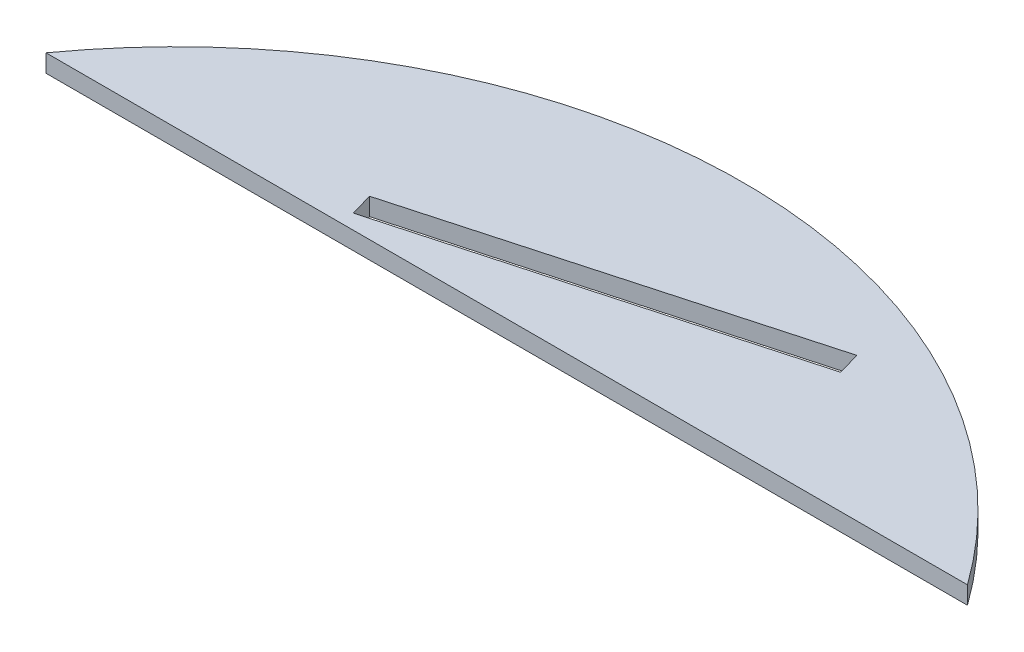
from build123d import *

# Parameters (mm, degrees)
SKETCH1_R           = 48
BOSS_EXTRUDE1_DEPTH = 1.5
CUT_EXTRUDE1_START  = -1.5
CUT_EXTRUDE1_DEPTH  = 1.5
CUT_EXTRUDE2_DEPTH  = 1.5


with BuildPart() as part:
    # Sketch1 → Boss-Extrude1 (new body)
    with BuildSketch(Plane(origin=(0, 0, 0), x_dir=(1, 0, 0), z_dir=(0, 1, 0))):
        with Locations(Location((0, 0, 0), (0, 0, 270))):
            Circle(SKETCH1_R)
    extrude(amount=BOSS_EXTRUDE1_DEPTH)

    # Sketch2 → Cut-Extrude1 (cut)
    with BuildSketch(Plane(origin=(0, 1.5, 0), x_dir=(1, 0, 0), z_dir=(0, 1, 0)).offset(CUT_EXTRUDE1_START)):
        with BuildLine():
            Line((-38.987177379, 28), (38.987177379, 28))
            ThreePointArc((38.987177379, 28), (0, -48), (-38.987177379, 28))
        make_face()
    extrude(amount=CUT_EXTRUDE1_DEPTH, mode=Mode.SUBTRACT)

    # Sketch3 → Cut-Extrude2 (cut)
    with BuildSketch(Plane(origin=(0, 1.5, 0), x_dir=(1, 0, 0), z_dir=(0, 1, 0))):
        Polygon((17.498096782, 40.137165991), (-14.782501595, 31.180996698), (-14.24780465, 29.253796759), (18.036697969, 38.211053647), align=None)
    extrude(amount=-CUT_EXTRUDE2_DEPTH, mode=Mode.SUBTRACT)


solid = part.part
